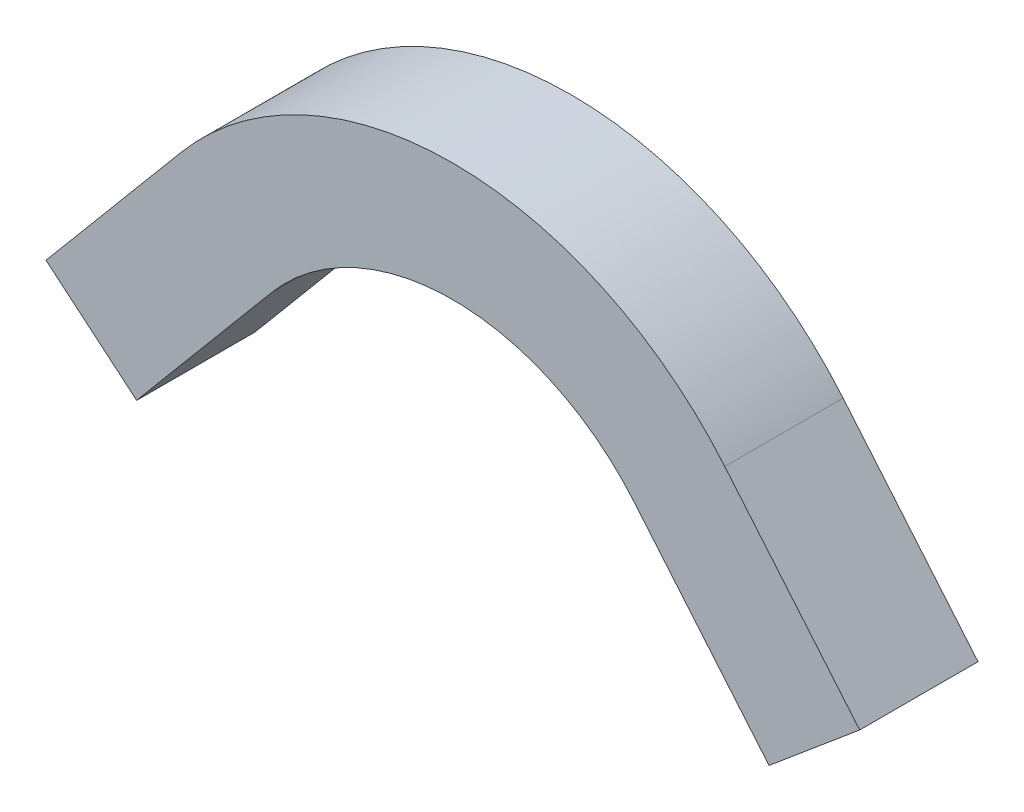
from build123d import *

# Parameters (mm, degrees)
BOSS_EXTRUDE1_DEPTH = 10
SKETCH2_W           = 20
SKETCH2_H           = 20
BOSS_EXTRUDE2_DEPTH = 26.2
BOSS_EXTRUDE3_DEPTH = 20


with BuildPart() as part:
    # Sketch1 → Boss-Extrude1 (new, symmetric)
    with BuildSketch(Plane.XY):
        with BuildLine():
            Line((45.962666587, 38.567256581), (30.641777725, 25.711504387))
            ThreePointArc((30.641777725, 25.711504387), (0, 40), (-30.641777725, 25.711504387))
            Line((-30.641777725, 25.711504387), (-45.962666587, 38.567256581))
            ThreePointArc((-45.962666587, 38.567256581), (0, 60), (45.962666587, 38.567256581))
        make_face()
    extrude(amount=BOSS_EXTRUDE1_DEPTH, both=True)

    # Sketch2 → Boss-Extrude2 (add)
    with BuildSketch(Plane(origin=(0, 0, 0), x_dir=(0, 0, 1), z_dir=(-0.6427876096865383, -0.7660444431189791, 0))):
        with Locations((0, 50)):
            Rectangle(SKETCH2_W, SKETCH2_H)
    boss_extrude2 = extrude(amount=BOSS_EXTRUDE2_DEPTH)

    # Mirror1: Boss-Extrude2 across plane
    add(boss_extrude2.mirror(Plane.ZY))

    # Sketch3 → Boss-Extrude3 (add)
    with BuildSketch(Plane(origin=(0, 0, -10), x_dir=(-1, 0, 0), z_dir=(0, 0, -1))):
        Polygon((47.482813099, 5.641139978), (62.803701961, 18.496892171), (68.765030296, 11.392457711), (53.444141434, -1.463294483), align=None)
        Polygon((-53.444141434, -1.463294483), (-68.765030296, 11.392457711), (-62.803701961, 18.496892171), (-47.482813099, 5.641139978), align=None)
    extrude(amount=-BOSS_EXTRUDE3_DEPTH)


solid = part.part
